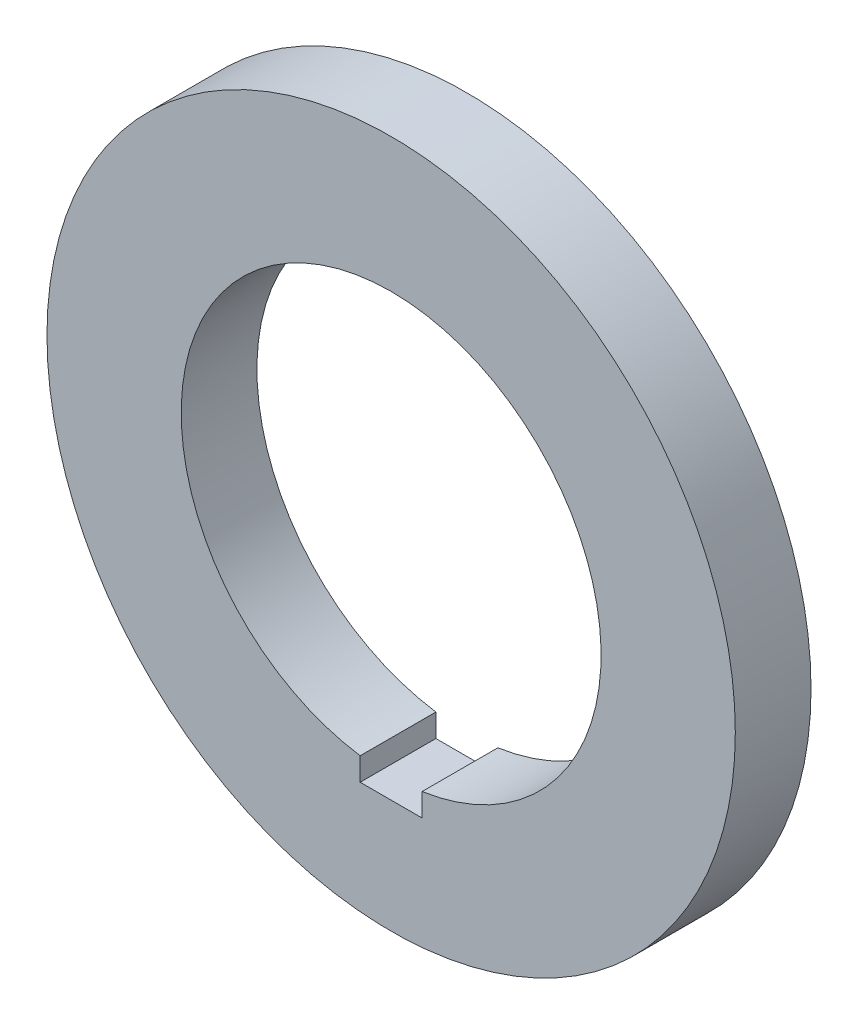
from build123d import *

# Parameters (mm, degrees)
SKETCH1_R           = 25
SKETCH1_R_2         = 15.25
BOSS_EXTRUDE1_DEPTH = 5.5
SKETCH2_W           = 4.5
SKETCH2_H           = 3
CUT_EXTRUDE1_DEPTH  = 36.780581326


with BuildPart() as part:
    # Sketch1 → Boss-Extrude1 (new body)
    with BuildSketch(Plane.XY):
        Circle(SKETCH1_R)
        Circle(SKETCH1_R_2, mode=Mode.SUBTRACT)
    extrude(amount=BOSS_EXTRUDE1_DEPTH)

    # Sketch2 → Cut-Extrude1 (cut, through all)
    with BuildSketch(Plane(origin=(0, 0, 0), x_dir=(-1, 0, 0), z_dir=(0, 0, -1))):
        with Locations((0, -15.25)):
            Rectangle(SKETCH2_W, SKETCH2_H)
    extrude(amount=-CUT_EXTRUDE1_DEPTH, mode=Mode.SUBTRACT)


solid = part.part
